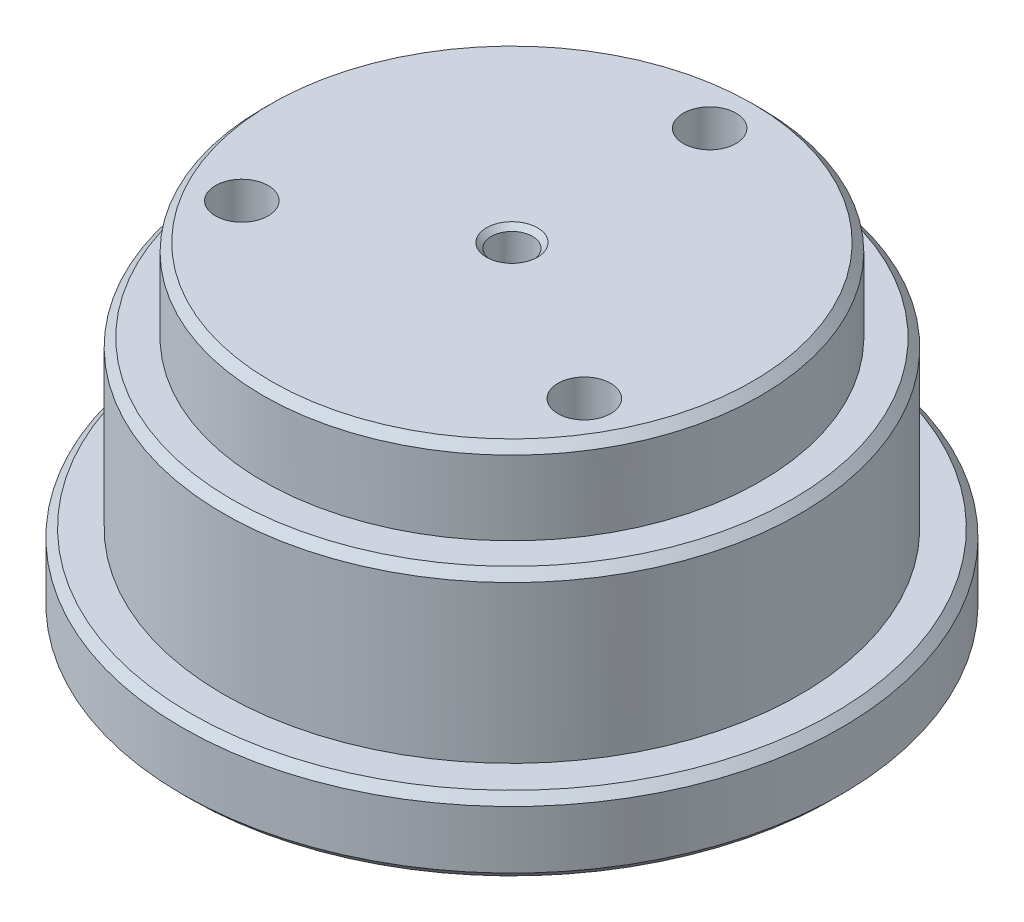
from build123d import *

# Parameters (mm, degrees)
SKETCH_1_R               = 20
EXTRUDE_1_DEPTH          = 19.5
CUT_EXTRUDE_START        = 4.5
SKETCH_2_OUTSIDE_W       = 53.968
SKETCH_2_OUTSIDE_H       = 53.968
SKETCH_2_OUTSIDE_R       = 17.5
CUT_EXTRUDE_1_DEPTH      = 30.854766773
CUT_EXTRUDE_START_2      = -14.5
SKETCH_3_OUTSIDE_W       = 53.968
SKETCH_3_OUTSIDE_H       = 53.968
SKETCH_3_OUTSIDE_R       = 15.1
CUT_EXTRUDE_2_DEPTH      = 6
SKETCH_4_R               = 1.25
CUT_EXTRUDE_3_DEPTH      = 35.354766773
SKETCH_4_3_R             = 1.6
CUT_EXTRUDE_4_DEPTH      = 35.354766773
SKETCH_4_4_R             = 3.25
SKETCH_4_4_R_2           = 1.6
CUT_EXTRUDE_5_DEPTH      = 4
PATTERN_CIRCULAR_1_COUNT = 3
CHAMFER_1_SIZE           = 0.5
SKETCH_4_5_R             = 3
SKETCH_4_5_R_2           = 1.25
CUT_EXTRUDE_6_DEPTH      = 4
CHAMFER_2_SIZE           = 0.3


with BuildPart() as part:
    # Эскиз1 → Бобышка-Вытянуть1 (new body)
    with BuildSketch(Plane(origin=(0, 0, 0), x_dir=(1, 0, 0), z_dir=(0, 1, 0))):
        Circle(SKETCH_1_R)
    extrude(amount=EXTRUDE_1_DEPTH)

    # Эскиз2 outside → Вырез-Вытянуть1 (cut, through all)
    with BuildSketch(Plane(origin=(0, 0, 0), x_dir=(1, 0, 0), z_dir=(0, 1, 0)).offset(CUT_EXTRUDE_START)):
        Rectangle(SKETCH_2_OUTSIDE_W, SKETCH_2_OUTSIDE_H)
        Circle(SKETCH_2_OUTSIDE_R, mode=Mode.SUBTRACT)
    extrude(amount=CUT_EXTRUDE_1_DEPTH, mode=Mode.SUBTRACT)

    # Эскиз3 outside → Вырез-Вытянуть2 (cut)
    with BuildSketch(Plane.XZ.offset(CUT_EXTRUDE_START_2)):
        Rectangle(SKETCH_3_OUTSIDE_W, SKETCH_3_OUTSIDE_H)
        Circle(SKETCH_3_OUTSIDE_R, mode=Mode.SUBTRACT)
    extrude(amount=-CUT_EXTRUDE_2_DEPTH, mode=Mode.SUBTRACT)

    # Эскиз4 → Вырез-Вытянуть3 (cut, through all)
    with BuildSketch(Plane(origin=(0, 0, 0), x_dir=(1, 0, 0), z_dir=(0, 1, 0))):
        Circle(SKETCH_4_R)
    extrude(amount=CUT_EXTRUDE_3_DEPTH, mode=Mode.SUBTRACT)

    # Эскиз4<3> → Вырез-Вытянуть4 (cut, through all)
    with BuildSketch(Plane(origin=(0, 0, 0), x_dir=(1, 0, 0), z_dir=(0, 1, 0))):
        with Locations((0, 12)):
            Circle(SKETCH_4_3_R)
    cut_extrude_4 = extrude(amount=CUT_EXTRUDE_4_DEPTH, mode=Mode.SUBTRACT)

    # Эскиз4<4> → Вырез-Вытянуть5 (cut)
    with BuildSketch(Plane(origin=(0, 0, 0), x_dir=(1, 0, 0), z_dir=(0, 1, 0))):
        with Locations((0, 12)):
            Circle(SKETCH_4_4_R)
        with Locations((0, 12)):
            Circle(SKETCH_4_4_R_2, mode=Mode.SUBTRACT)
    cut_extrude_5 = extrude(amount=CUT_EXTRUDE_5_DEPTH, mode=Mode.SUBTRACT)

    # Круговой массив1: Вырез-Вытянуть4, Вырез-Вытянуть5 ×3 about axis
    pattern_circular_1_axis = Axis((0, 19.5, 0), (0, -1, 0))
    add([cut_extrude_4.rotate(pattern_circular_1_axis, i * 360 / PATTERN_CIRCULAR_1_COUNT) for i in range(1, PATTERN_CIRCULAR_1_COUNT)], mode=Mode.SUBTRACT)
    add([cut_extrude_5.rotate(pattern_circular_1_axis, i * 360 / PATTERN_CIRCULAR_1_COUNT) for i in range(1, PATTERN_CIRCULAR_1_COUNT)], mode=Mode.SUBTRACT)

    # Фаска1
    chamfer_1_edges = [part.edges().sort_by_distance(p)[0] for p in [
        (-20, 4.5, 0),
        (-20, 0, 0),
        (-15.1, 19.5, 0),
        (-17.5, 14.5, 0),
    ]]
    chamfer(chamfer_1_edges, length=CHAMFER_1_SIZE)

    # Эскиз4<5> → Вырез-Вытянуть6 (cut)
    with BuildSketch(Plane(origin=(0, 0, 0), x_dir=(1, 0, 0), z_dir=(0, 1, 0))):
        Circle(SKETCH_4_5_R)
        Circle(SKETCH_4_5_R_2, mode=Mode.SUBTRACT)
    extrude(amount=CUT_EXTRUDE_6_DEPTH, mode=Mode.SUBTRACT)

    # Фаска2
    chamfer_2_edges = [part.edges().sort_by_distance(p)[0] for p in [
        (-1.25, 19.5, 0),
        (-3, 0, 0),
    ]]
    chamfer(chamfer_2_edges, length=CHAMFER_2_SIZE)


solid = part.part
